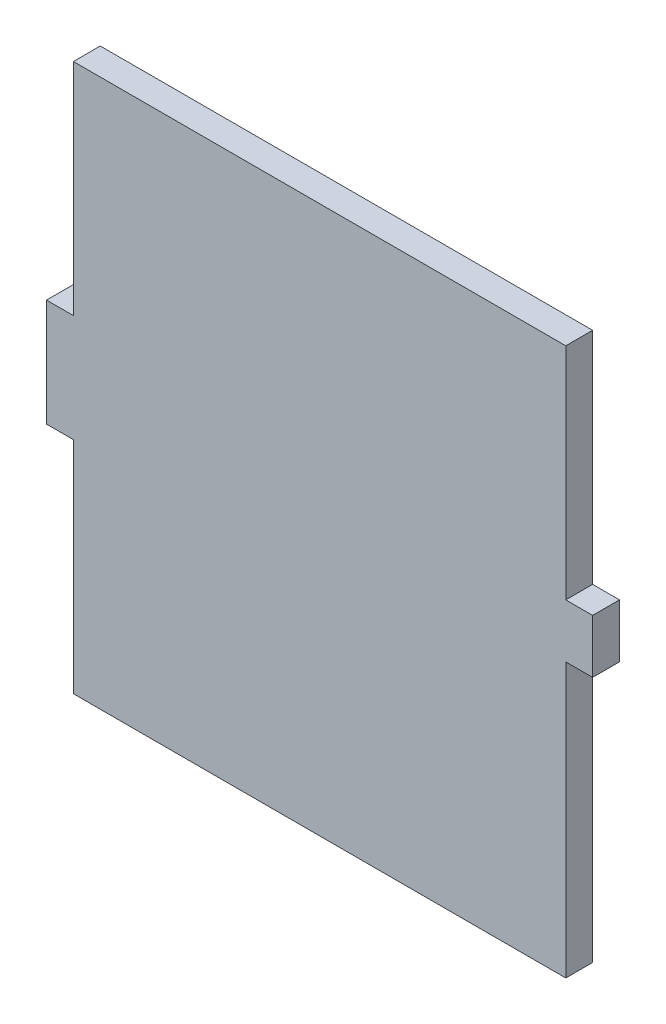
from build123d import *

# Parameters (mm, degrees)
P_IDAT_VYSUNUT_M1_DEPTH = 3


with BuildPart() as part:
    # Skica1 → Přidat vysunutím1 (new body)
    with BuildSketch(Plane.XY):
        Polygon((55, -30.58), (55, -61.16), (0, -61.16), (0, -36.58), (-3, -36.58), (-3, -24.58), (0, -24.58), (0, 0), (55, 0), (55, -24.58), (58, -24.58), (58, -30.58), align=None)
    extrude(amount=P_IDAT_VYSUNUT_M1_DEPTH)


solid = part.part
